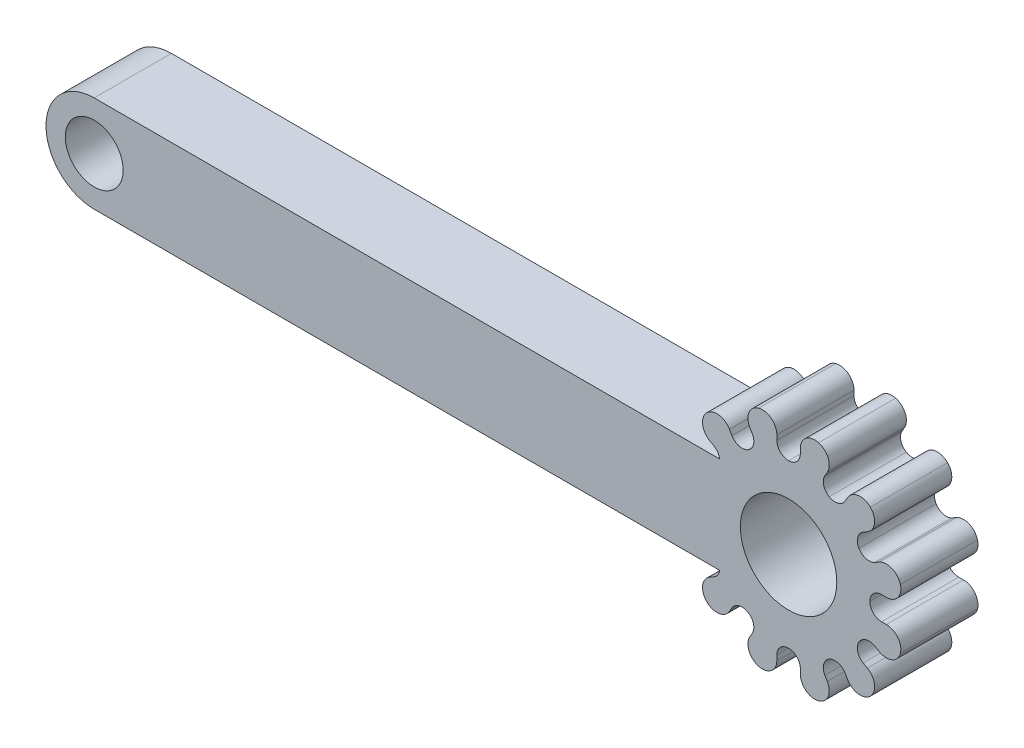
from build123d import *

# Parameters (mm, degrees)
SKETCH1_R           = 1.5
BOSS_EXTRUDE1_DEPTH = 4
CUT_EXTRUDE1_DEPTH  = 26.059928172
CIRPATTERN1_COUNT   = 12
SKETCH3_W           = 5.990659071
SKETCH3_H           = 5
BOSS_EXTRUDE2_DEPTH = 4
SKETCH4_R           = 2.5
CUT_EXTRUDE2_DEPTH  = 25.846159393


with BuildPart() as part:
    # Sketch1 → Boss-Extrude1 (new body)
    with BuildSketch(Plane.XY):
        with BuildLine():
            Line((-18, 2.5), (12.545643943, 2.5))
            ThreePointArc((12.545643943, 2.5), (24, 0), (12.545643943, -2.5))
            Line((12.545643943, -2.5), (-18, -2.5))
            ThreePointArc((-18, -2.5), (-20.5, 0), (-18, 2.5))
        make_face()
        with Locations((-18, 0)):
            Circle(SKETCH1_R, mode=Mode.SUBTRACT)
    extrude(amount=BOSS_EXTRUDE1_DEPTH)

    # Sketch2 → Cut-Extrude1 (cut, through all)
    with BuildSketch(Plane.XY.offset(4)):
        with BuildLine():
            Line((20.008070513, 4.695554958), (19.882890915, 4.479152397))
            ThreePointArc((19.882890915, 4.479152397), (19.821496871, 4.016588638), (20.105, 3.64596695))
            ThreePointArc((20.105, 3.64596695), (20.567719361, 3.585756883), (20.937614306, 3.870207564))
            Line((20.937614306, 3.870207564), (21.062434622, 4.086817556))
            ThreePointArc((21.062434622, 4.086817556), (21.614093727, 4.455903836), (22.242640687, 4.242640687))
            ThreePointArc((22.242640687, 4.242640687), (21.131352886, 5.423662295), (19.552914271, 5.795554958))
            ThreePointArc((19.552914271, 5.795554958), (20.051879055, 5.357848898), (20.008070513, 4.695554958))
        make_face()
    cut_extrude1 = extrude(amount=-CUT_EXTRUDE1_DEPTH, mode=Mode.SUBTRACT)

    # CirPattern1: Cut-Extrude1 ×12 about axis
    cirpattern1_axis = Axis((18, 0, 0), (0, 0, 1))
    for i in range(1, CIRPATTERN1_COUNT):
        add(cut_extrude1.rotate(cirpattern1_axis, i * 360 / CIRPATTERN1_COUNT), mode=Mode.SUBTRACT)

    # Sketch3 → Boss-Extrude2 (add)
    with BuildSketch(Plane.XY.offset(4)):
        with Locations((13.282390893, 0)):
            Rectangle(SKETCH3_W, SKETCH3_H)
    extrude(amount=-BOSS_EXTRUDE2_DEPTH)

    # Sketch4 → Cut-Extrude2 (cut, through all)
    with BuildSketch(Plane.XY.offset(4)):
        with Locations((18, 0)):
            Circle(SKETCH4_R)
    extrude(amount=-CUT_EXTRUDE2_DEPTH, mode=Mode.SUBTRACT)


solid = part.part
